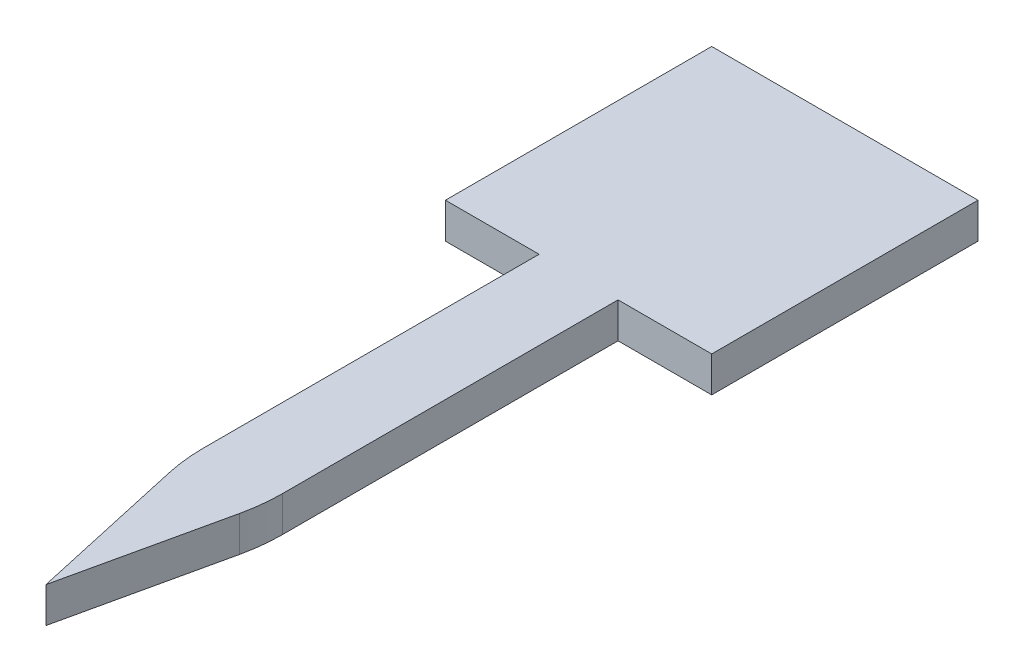
from build123d import *

# Parameters (mm, degrees)
IZIM1_W                     = 15
IZIM1_H                     = 15
Y_KSEKLIK_EKSTR_ZYON1_DEPTH = 2
IZIM2_W                     = 2.224225473
IZIM2_H                     = 2
Y_KSEKLIK_EKSTR_ZYON2_DEPTH = 20
Y_KSEKLIK_EKSTR_ZYON3_DEPTH = 2
RADYUS1_R                   = 10
RADYUS2_R                   = 10


with BuildPart() as part:
    # Çizim1 → Yükseklik-Ekstrüzyon1 (new body)
    with BuildSketch(Plane(origin=(0, 0, 0), x_dir=(1, 0, 0), z_dir=(0, 1, 0))):
        Rectangle(IZIM1_W, IZIM1_H)
    extrude(amount=Y_KSEKLIK_EKSTR_ZYON1_DEPTH)

    # Çizim2 → Yükseklik-Ekstrüzyon2 (add)
    with BuildSketch(Plane.XY.offset(7.5)):
        with Locations((1.112112737, 1)):
            Rectangle(IZIM2_W, IZIM2_H)
        with Locations((-1.112112737, 1)):
            Rectangle(IZIM2_W, IZIM2_H)
    extrude(amount=Y_KSEKLIK_EKSTR_ZYON2_DEPTH)

    # Çizim3 → Yükseklik-Ekstrüzyon3 (add)
    with BuildSketch(Plane(origin=(0, 0, 0), x_dir=(1, 0, 0), z_dir=(0, 1, 0))):
        Polygon((-2.224225473, -27.5), (2.224225473, -27.5), (0, -37.5), align=None)
    extrude(amount=Y_KSEKLIK_EKSTR_ZYON3_DEPTH)

    # Radyus1
    radyus1_edges = [part.edges().sort_by_distance(p)[0] for p in [
        (-2.224225473, 1, 27.5),
    ]]
    fillet(radyus1_edges, radius=RADYUS1_R)

    # Radyus2
    radyus2_edges = [part.edges().sort_by_distance(p)[0] for p in [
        (2.224225473, 1, 27.5),
    ]]
    fillet(radyus2_edges, radius=RADYUS2_R)


solid = part.part
